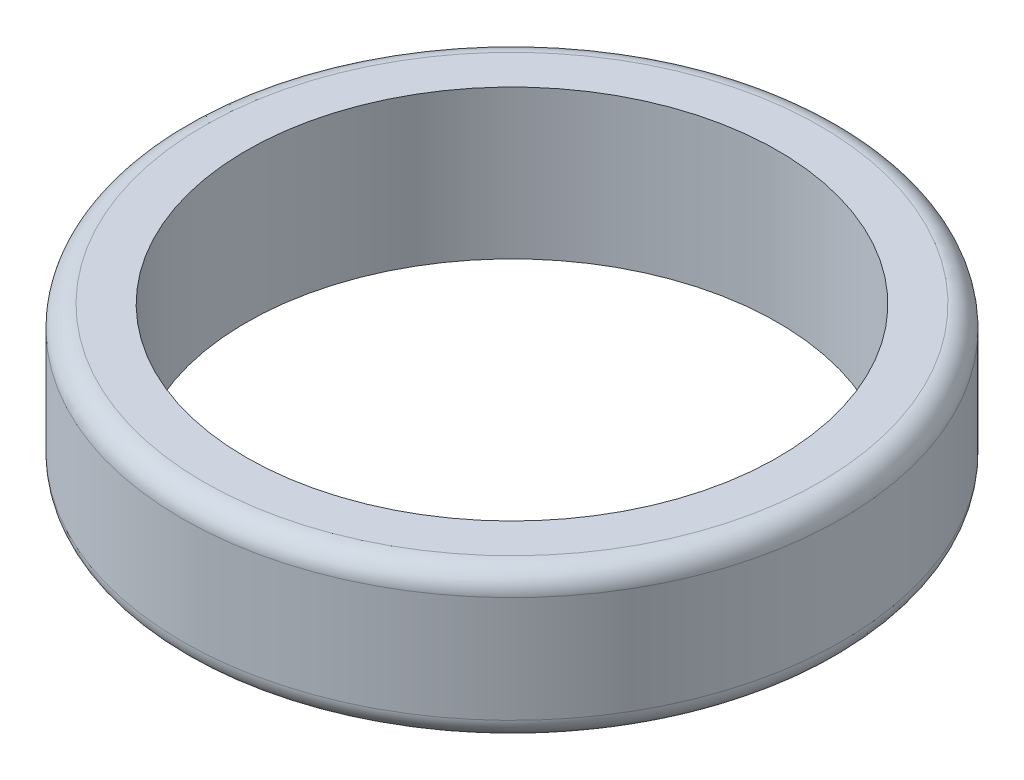
from build123d import *

# Parameters (mm, degrees)
SKETCH1_R           = 15.5
SKETCH1_R_2         = 12.5
BOSS_EXTRUDE1_DEPTH = 7
FILLET1_R           = 1


with BuildPart() as part:
    # Sketch1 → Boss-Extrude1 (new body)
    with BuildSketch(Plane(origin=(0, 0, 0), x_dir=(1, 0, 0), z_dir=(0, 1, 0))):
        with Locations(Location((0, 0, 0), (0, 0, 270))):
            Circle(SKETCH1_R)
        with Locations(Location((0, 0, 0), (0, 0, 270))):
            Circle(SKETCH1_R_2, mode=Mode.SUBTRACT)
    extrude(amount=BOSS_EXTRUDE1_DEPTH)

    # Fillet1
    fillet1_edges = [part.edges().sort_by_distance(p)[0] for p in [
        (0, 0, -15.5),
        (0, 7, -15.5),
    ]]
    fillet(fillet1_edges, radius=FILLET1_R)


solid = part.part
